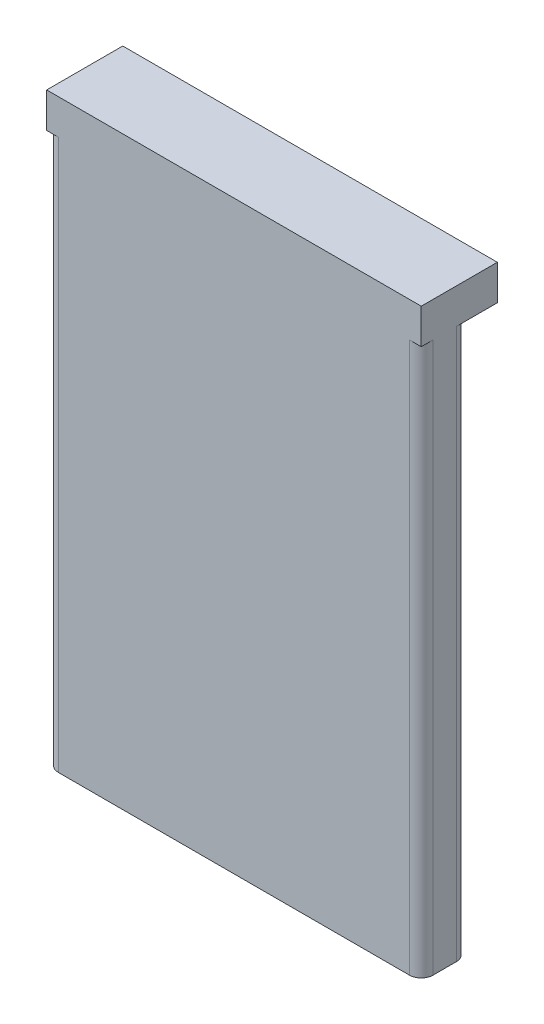
from build123d import *

# Parameters (mm, degrees)
SKETCH1_W      = 32
SKETCH1_H      = 50
EXTRUDE1_DEPTH = 4
FILLET1_R      = 1
SKETCH3_W      = 32
SKETCH3_H      = 6.5
EXTRUDE3_DEPTH = 3


with BuildPart() as part:
    # Sketch1 → Extrude1 (new body)
    with BuildSketch(Plane.XY):
        with Locations((0, 25)):
            Rectangle(SKETCH1_W, SKETCH1_H)
    extrude(amount=EXTRUDE1_DEPTH)

    # Fillet1
    fillet1_edges = [part.edges().sort_by_distance(p)[0] for p in [
        (16, 25, 4),
        (-16, 25, 4),
        (16, 25, 0),
        (-16, 25, 0),
    ]]
    fillet(fillet1_edges, radius=FILLET1_R)

    # Sketch3 → Extrude3 (add)
    with BuildSketch(Plane(origin=(0, 50, 0), x_dir=(1, 0, 0), z_dir=(0, 1, 0))):
        with Locations((0, -0.75)):
            Rectangle(SKETCH3_W, SKETCH3_H)
    extrude(amount=-EXTRUDE3_DEPTH)


solid = part.part
